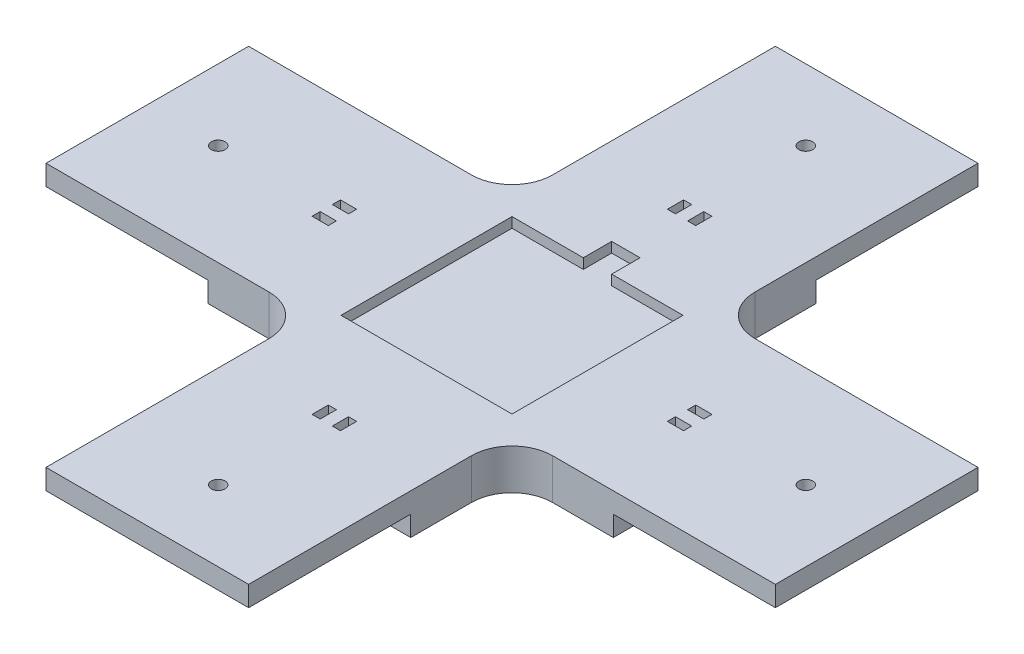
from build123d import *

# Parameters (mm, degrees)
BOSS_EXTRUDE2_DEPTH = 25
CIRPATTERN2_COUNT   = 4
CUT_EXTRUDE2_DEPTH  = 2.5
FILLET1_R           = 10
SKETCH8_R           = 1.7
CUT_EXTRUDE3_DEPTH  = 128.671453348
CIRPATTERN3_COUNT   = 4
SKETCH10_W          = 4
SKETCH10_H          = 2
CUT_EXTRUDE4_DEPTH  = 128.671453348
SKETCH11_W          = 8
SKETCH11_H          = 10
CUT_EXTRUDE5_DEPTH  = 7
CIRPATTERN4_COUNT   = 4


with BuildPart() as part:
    # Sketch2 → Boss-Extrude2 (new, symmetric)
    with BuildSketch(Plane.XY):
        Polygon((-50, 0), (50, 0), (50, 5), (90, 5), (90, 10), (-90, 10), (-90, 5), (-50, 5), align=None)
    boss_extrude2 = extrude(amount=BOSS_EXTRUDE2_DEPTH, both=True)

    # CirPattern2: Boss-Extrude2 ×4 about axis
    cirpattern2_axis = Axis((0, 0, 0), (0, 1, 0))
    for i in range(1, CIRPATTERN2_COUNT):
        add(boss_extrude2.rotate(cirpattern2_axis, i * 360 / CIRPATTERN2_COUNT))

    # Sketch4 → Cut-Extrude2 (cut, symmetric)
    with BuildSketch(Plane(origin=(0, 10, 0), x_dir=(1, 0, 0), z_dir=(0, 1, 0))):
        Polygon((-3.5, 21.1), (-21.1, 21.1), (-21.1, -21.1), (21.1, -21.1), (21.1, 21.1), (3.5, 21.1), (3.5, 28.1), (-3.5, 28.1), align=None)
    extrude(amount=CUT_EXTRUDE2_DEPTH, both=True, mode=Mode.SUBTRACT)

    # Fillet1
    fillet1_edges = [part.edges().sort_by_distance(p)[0] for p in [
        (-25, 5, 25),
        (25, 5, -25),
        (25, 5, 25),
        (-25, 5, -25),
    ]]
    fillet(fillet1_edges, radius=FILLET1_R)

    # Sketch8 → Cut-Extrude3 (cut, through all)
    with BuildSketch(Plane(origin=(0, 10, 0), x_dir=(1, 0, 0), z_dir=(0, 1, 0))):
        with Locations(Location((-72.5, 0, 0), (0, 0, 270))):
            Circle(SKETCH8_R)
    cut_extrude3 = extrude(amount=-CUT_EXTRUDE3_DEPTH, mode=Mode.SUBTRACT)

    # CirPattern3: Cut-Extrude3 ×4 about axis
    cirpattern3_axis = Axis((0, 0, 0), (0, 1, 0))
    for i in range(1, CIRPATTERN3_COUNT):
        add(cut_extrude3.rotate(cirpattern3_axis, i * 360 / CIRPATTERN3_COUNT), mode=Mode.SUBTRACT)

    # Sketch10 → Cut-Extrude4 (cut, through all)
    with BuildSketch(Plane(origin=(0, 10, 0), x_dir=(1, 0, 0), z_dir=(0, 1, 0))):
        with Locations((-43.840620434, 2.5)):
            Rectangle(SKETCH10_W, SKETCH10_H)
        with Locations((-43.840620434, -2.5)):
            Rectangle(SKETCH10_W, SKETCH10_H)
    cut_extrude4 = extrude(amount=-CUT_EXTRUDE4_DEPTH, mode=Mode.SUBTRACT)

    # Sketch11 → Cut-Extrude5 (cut)
    with BuildSketch(Plane.XZ):
        with Locations((-43.840620434, 0)):
            Rectangle(SKETCH11_W, SKETCH11_H)
    cut_extrude5 = extrude(amount=-CUT_EXTRUDE5_DEPTH, mode=Mode.SUBTRACT)

    # CirPattern4: Cut-Extrude4, Cut-Extrude5 ×4 about axis
    cirpattern4_axis = Axis((0, 0, 0), (0, 1, 0))
    add([cut_extrude4.rotate(cirpattern4_axis, i * 360 / CIRPATTERN4_COUNT) for i in range(1, CIRPATTERN4_COUNT)], mode=Mode.SUBTRACT)
    add([cut_extrude5.rotate(cirpattern4_axis, i * 360 / CIRPATTERN4_COUNT) for i in range(1, CIRPATTERN4_COUNT)], mode=Mode.SUBTRACT)


solid = part.part
